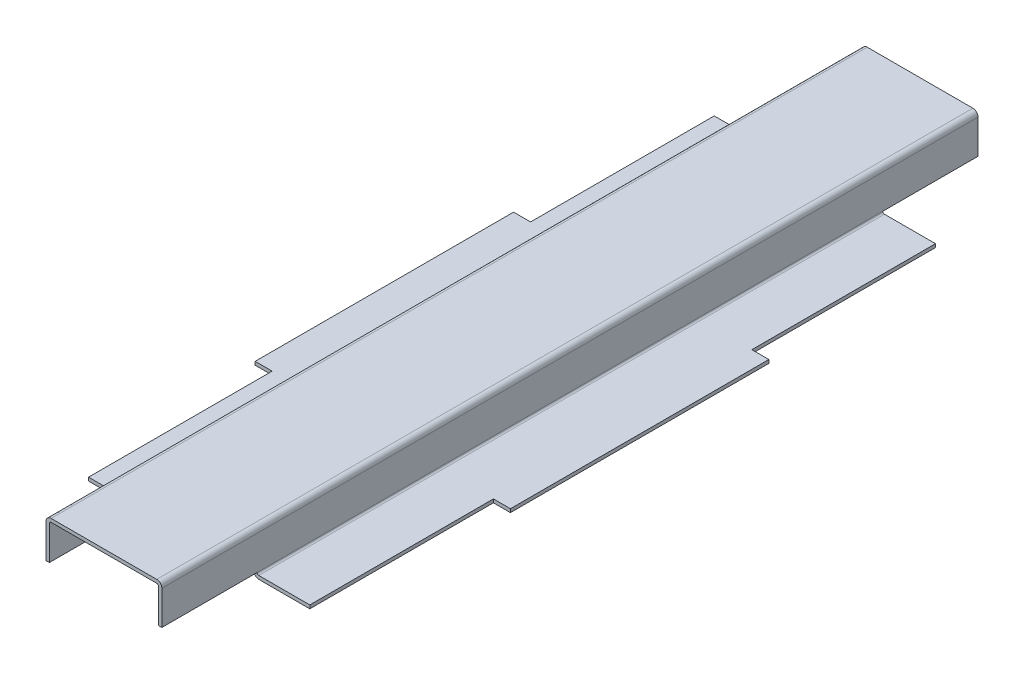
from build123d import *

# Parameters (mm, degrees)
EXTRUDE_THIN1_DEPTH = 584.2
BOSS_EXTRUDE1_START = 177.8
BOSS_EXTRUDE1_DEPTH = 177.8
SKETCH4_W           = 482.6
SKETCH4_H           = 6.35
BOSS_EXTRUDE2_DEPTH = 31.75


with BuildPart() as part:
    # Sketch1 → Extrude-Thin1 (new, symmetric)
    with BuildSketch(Plane.XY):
        with BuildLine():
            Line((-206.6, -79.375), (-111.35, -79.375))
            ThreePointArc((-111.35, -79.375), (-104.614807909, -76.585192091), (-101.825, -69.85))
            Line((-101.825, -69.85), (-101.825, -6.35))
            ThreePointArc((-101.825, -6.35), (-100.89506403, -4.10493597), (-98.65, -3.175))
            Line((-98.65, -3.175), (98.65, -3.175))
            ThreePointArc((98.65, -3.175), (100.89506403, -4.10493597), (101.825, -6.35))
            Line((101.825, -6.35), (101.825, -69.85))
            ThreePointArc((101.825, -69.85), (104.614807909, -76.585192091), (111.35, -79.375))
            Line((111.35, -79.375), (206.6, -79.375))
            Line((206.6, -79.375), (206.6, -73.025))
            Line((206.6, -73.025), (111.35, -73.025))
            ThreePointArc((111.35, -73.025), (109.10493597, -72.09506403), (108.175, -69.85))
            Line((108.175, -69.85), (108.175, -6.35))
            ThreePointArc((108.175, -6.35), (105.385192091, 0.385192091), (98.65, 3.175))
            Line((98.65, 3.175), (-98.65, 3.175))
            ThreePointArc((-98.65, 3.175), (-105.385192091, 0.385192091), (-108.175, -6.35))
            Line((-108.175, -6.35), (-108.175, -69.85))
            ThreePointArc((-108.175, -69.85), (-109.10493597, -72.09506403), (-111.35, -73.025))
            Line((-111.35, -73.025), (-206.6, -73.025))
            Line((-206.6, -73.025), (-206.6, -79.375))
        make_face()
    extrude(amount=EXTRUDE_THIN1_DEPTH, both=True)

    # Sketch3 → Boss-Extrude1 (add)
    with BuildSketch(Plane.XY.offset(584.2).offset(BOSS_EXTRUDE1_START)):
        with BuildLine():
            Line((-108.175, -69.85), (-101.825, -69.85))
            Line((-101.825, -69.85), (-101.825, -6.35))
            ThreePointArc((-101.825, -6.35), (-100.89506403, -4.10493597), (-98.65, -3.175))
            Line((-98.65, -3.175), (98.65, -3.175))
            ThreePointArc((98.65, -3.175), (100.89506403, -4.10493597), (101.825, -6.35))
            Line((101.825, -6.35), (101.825, -69.85))
            Line((101.825, -69.85), (108.175, -69.85))
            Line((108.175, -69.85), (108.175, -6.35))
            ThreePointArc((108.175, -6.35), (105.385192091, 0.385192091), (98.65, 3.175))
            Line((98.65, 3.175), (-98.65, 3.175))
            ThreePointArc((-98.65, 3.175), (-105.385192091, 0.385192091), (-108.175, -6.35))
            Line((-108.175, -6.35), (-108.175, -69.85))
        make_face()
    boss_extrude1 = extrude(amount=-BOSS_EXTRUDE1_DEPTH)

    # Sketch4 → Boss-Extrude2 (add)
    with BuildSketch(Plane(origin=(206.6, 0, 0), x_dir=(0, 0, -1), z_dir=(1, 0, 0))):
        with Locations((0, -76.2)):
            Rectangle(SKETCH4_W, SKETCH4_H)
    boss_extrude2 = extrude(amount=BOSS_EXTRUDE2_DEPTH)

    # Mirror1: Boss-Extrude1 across plane
    add(boss_extrude1.mirror(Plane.XY))

    # Mirror2: Boss-Extrude2 across plane
    add(boss_extrude2.mirror(Plane(origin=(0, 0, 0), x_dir=(0, 0, 1), z_dir=(1, 0, 0))))


solid = part.part
